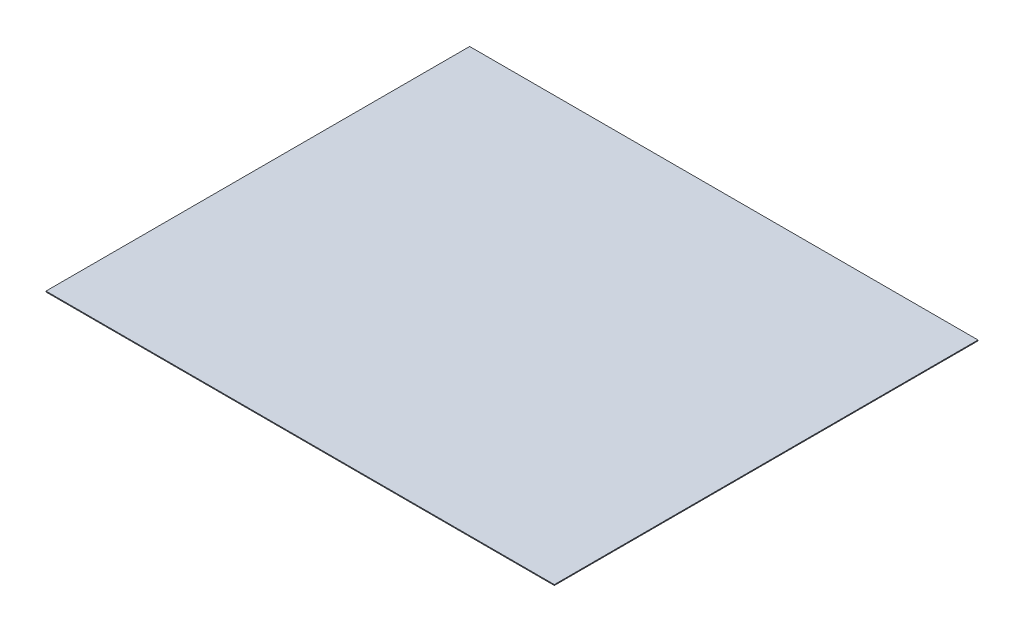
from build123d import *

# Parameters (mm, degrees)
SKETCH_2_W      = 1800
SKETCH_2_H      = 1500
EXTRUDE_1_DEPTH = 3


with BuildPart() as part:
    # 草图2 → 凸台-拉伸1 (new body)
    with BuildSketch(Plane(origin=(0, 0, 0), x_dir=(1, 0, 0), z_dir=(0, 1, 0))):
        Rectangle(SKETCH_2_W, SKETCH_2_H)
    extrude(amount=EXTRUDE_1_DEPTH)


solid = part.part
